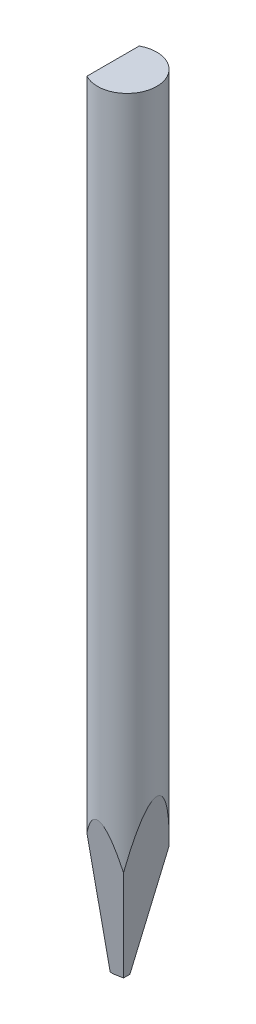
from build123d import *

# Parameters (mm, degrees)
TD_SKETCH_R                   = 0.79248
TL_FEATURE_DEPTH              = 21.0312
TDF_STD_SKETCH_W              = 1.60495996
TDF_STD_SKETCH_H              = 1.60495996
TDF_STD_FEATURE_DEPTH         = 22.061040395
ISA_20_STD_FEATURE_DEPTH      = 22.061040395
ISA_20_STD_FEATURE_DEPTH_BACK = 22.061040395
F_10BA_STD_FEATURE_DEPTH      = 22.061040395
F_10BA_STD_FEATURE_DEPTH_BACK = 22.061040395


with BuildPart() as part:
    # TD_sketch → TL_feature (new body)
    with BuildSketch(Plane(origin=(0, 0, 0), x_dir=(1, 0, 0), z_dir=(0, 1, 0))):
        Circle(TD_SKETCH_R)
    extrude(amount=TL_FEATURE_DEPTH)

    # TDF_STD_sketch → TDF_STD_feature (cut, through all)
    with BuildSketch(Plane(origin=(0, 0, 0), x_dir=(1, 0, 0), z_dir=(0, 1, 0))):
        with Locations((-1.17839998, 0)):
            Rectangle(TDF_STD_SKETCH_W, TDF_STD_SKETCH_H)
    extrude(amount=TDF_STD_FEATURE_DEPTH, mode=Mode.SUBTRACT)

    # ISA_20_STD_sketch → ISA_20_STD_feature (cut, two sides: drawn at the far end of the back side and taken through both)
    with BuildSketch(Plane(origin=(0, 0, 0), x_dir=(0, 0, -1), z_dir=(1, 0, 0)).offset(-ISA_20_STD_FEATURE_DEPTH_BACK)):
        Polygon((-12.996080373, 73.27228267), (-3.784567997, 21.0312), (-0.0762, 0), (0.0762, 0), (3.784567997, 21.0312), (12.996080373, 73.27228267), (12.996080373, -32.821688483), (-12.996080373, -32.821688483), align=None)
    extrude(amount=ISA_20_STD_FEATURE_DEPTH + ISA_20_STD_FEATURE_DEPTH_BACK, mode=Mode.SUBTRACT)

    # 10BA_STD_sketch → 10BA_STD_feature (cut, two sides: drawn at the far end of the back side and taken through both)
    with BuildSketch(Plane.XY.offset(-F_10BA_STD_FEATURE_DEPTH_BACK)):
        Polygon((-53.216424634, 0), (-0.37592, 0), (-0.29972, 0), (-0.011354365, 0.050846642), (3.688047997, 21.0312), (12.863705333, 73.068938636), (91.245889802, 2.18375769), (25.165759835, -70.885180946), align=None)
    extrude(amount=F_10BA_STD_FEATURE_DEPTH + F_10BA_STD_FEATURE_DEPTH_BACK, mode=Mode.SUBTRACT)


solid = part.part
